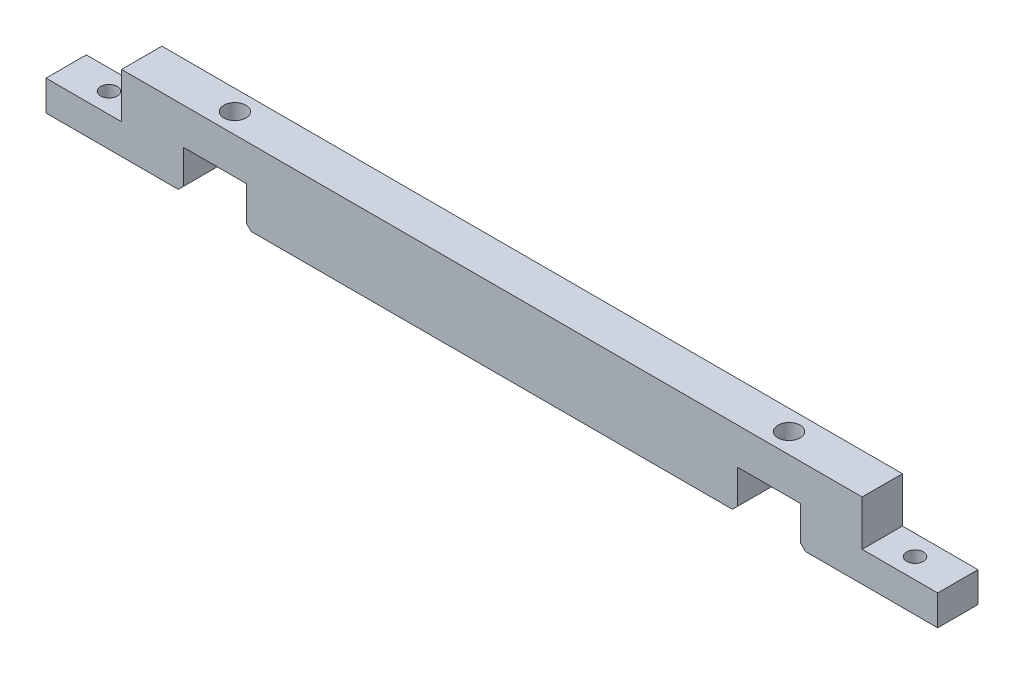
from build123d import *

# Parameters (mm, degrees)
SKETCH1_W                                           = 354
SKETCH1_H                                           = 16
BOSS_EXTRUDE1_DEPTH                                 = 15
M5_TAPPED_HOLE1_D                                   = 4.2
SKETCH7_W                                           = 25
SKETCH7_H                                           = 27.047818694
CUT_EXTRUDE2_DEPTH                                  = 179.353581405
CHAMFER1_SIZE                                       = 2
CHAMFER1_OF_MIRROR1_SIZE                            = 2
G1_8_TAPPED_HOLE1_D                                 = 8.8
G1_8_TAPPED_HOLE1_DEPTH                             = 9
G1_8_TAPPED_HOLE1_TIP                               = 2.643786724
SKETCH10_W                                          = 30
SKETCH10_H                                          = 18
CUT_EXTRUDE3_DEPTH                                  = 179.353581405
CBORE_FOR_M6_HEX_SOCKET_HEAD_CAP_SCREW1_D           = 6.6
CBORE_FOR_M6_HEX_SOCKET_HEAD_CAP_SCREW1_CBORE_D     = 11
CBORE_FOR_M6_HEX_SOCKET_HEAD_CAP_SCREW1_CBORE_DEPTH = 6.4


with BuildPart() as part:
    # Sketch1 → Boss-Extrude1 (new, symmetric)
    with BuildSketch(Plane(origin=(0, 0, 0), x_dir=(1, 0, 0), z_dir=(0, 1, 0))):
        Rectangle(SKETCH1_W, SKETCH1_H)
    extrude(amount=BOSS_EXTRUDE1_DEPTH, both=True)

    # M5 Tapped Hole1 (through all)
    with Locations(Plane(origin=(0, 15, 0), x_dir=(1, 0, 0), z_dir=(0, 1, 0))):
        with Locations((-110, 0), (110, 0)):
            Hole(M5_TAPPED_HOLE1_D / 2)

    # Sketch7 → Cut-Extrude2 (cut, through all)
    with BuildSketch(Plane.XY.offset(8)):
        with Locations((110, -13.023909347)):
            Rectangle(SKETCH7_W, SKETCH7_H)
    cut_extrude2 = extrude(amount=-CUT_EXTRUDE2_DEPTH, mode=Mode.SUBTRACT)

    # Chamfer1
    chamfer1_edges = [part.edges().sort_by_distance(p)[0] for p in [
        (122.5, -15, 0),
        (97.5, -15, 0),
    ]]
    chamfer(chamfer1_edges, length=CHAMFER1_SIZE)

    # Mirror1: Cut-Extrude2 across plane
    add(cut_extrude2.mirror(Plane(origin=(0, 0, 0), x_dir=(0, 0, 1), z_dir=(1, 0, 0))), mode=Mode.SUBTRACT)

    # Chamfer1 of Mirror1
    chamfer1_of_mirror1_edges = [part.edges().sort_by_distance(p)[0] for p in [
        (-122.5, -15, 0),
        (-97.5, -15, 0),
    ]]
    chamfer(chamfer1_of_mirror1_edges, length=CHAMFER1_OF_MIRROR1_SIZE)

    # G1/8 Tapped Hole1
    with Locations(Plane(origin=(0, 15, 0), x_dir=(1, 0, 0), z_dir=(0, 1, 0))):
        with Locations((-110, 0), (110, 0)):
            Hole(G1_8_TAPPED_HOLE1_D / 2, depth=G1_8_TAPPED_HOLE1_DEPTH)
            with Locations((0, 0, -(G1_8_TAPPED_HOLE1_DEPTH + G1_8_TAPPED_HOLE1_TIP / 2))):  # 118° drill point
                Cone(0, G1_8_TAPPED_HOLE1_D / 2, G1_8_TAPPED_HOLE1_TIP, mode=Mode.SUBTRACT)

    # Sketch10 → Cut-Extrude3 (cut, through all)
    with BuildSketch(Plane.XY.offset(8)):
        with Locations((-162, 6)):
            Rectangle(SKETCH10_W, SKETCH10_H)
    cut_extrude3 = extrude(amount=-CUT_EXTRUDE3_DEPTH, mode=Mode.SUBTRACT)

    # Mirror2: Cut-Extrude3 across plane
    add(cut_extrude3.mirror(Plane(origin=(0, 0, 0), x_dir=(0, 0, 1), z_dir=(1, 0, 0))), mode=Mode.SUBTRACT)

    # CBORE for M6 Hex Socket Head Cap Screw1 (through all)
    with Locations(Plane(origin=(0, -15, 0), x_dir=(-1, 0, 0), z_dir=(0, -1, 0))):
        with Locations((-160, 0), (160, 0)):
            CounterBoreHole(CBORE_FOR_M6_HEX_SOCKET_HEAD_CAP_SCREW1_D / 2, CBORE_FOR_M6_HEX_SOCKET_HEAD_CAP_SCREW1_CBORE_D / 2, CBORE_FOR_M6_HEX_SOCKET_HEAD_CAP_SCREW1_CBORE_DEPTH)


solid = part.part
